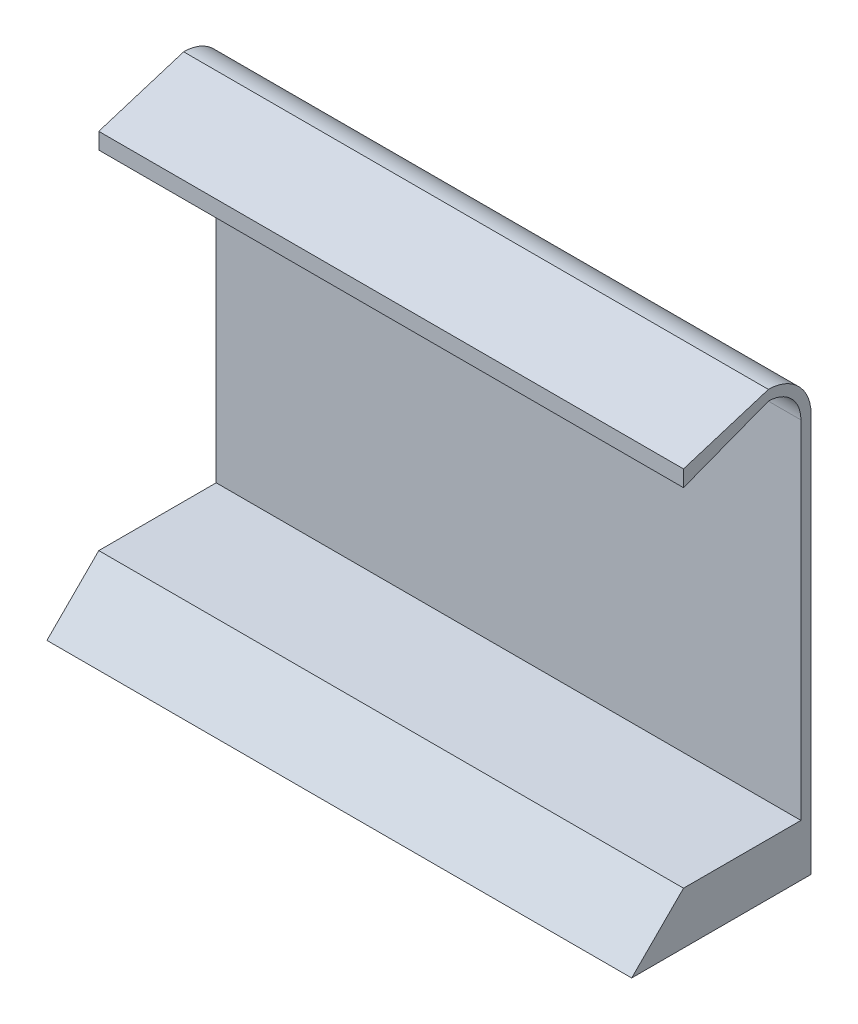
from build123d import *

# Parameters (mm, degrees)
BOSS_EXTRUDE1_DEPTH = 558.8


with BuildPart() as part:
    # Sketch1 → Boss-Extrude1 (new body)
    with BuildSketch(Plane(origin=(0, 0, 0), x_dir=(0, 0, -1), z_dir=(1, 0, 0))):
        with BuildLine():
            Line((0, 16.231012583), (0, -315.218136756))
            Line((0, -315.218136756), (-112.188138154, -315.218136756))
            Line((-112.188138154, -315.218136756), (-161.738988814, -364.768987417))
            Line((-161.738988814, -364.768987417), (0, -364.768987417))
            Line((0, -364.768987417), (9.710862229, -364.768987417))
            Line((9.710862229, -364.768987417), (9.710862229, 16.231012583))
            ThreePointArc((9.710862229, 16.231012583), (-2.234969693, 45.070802024), (-31.074759134, 57.016633947))
            Line((-31.074759134, 57.016633947), (-112.188138154, 31.76839215))
            Line((-112.188138154, 31.76839215), (-112.188138154, 16.231012583))
            Line((-112.188138154, 16.231012583), (-31.074759134, 47.305771717))
            ThreePointArc((-31.074759134, 47.305771717), (-9.101586227, 38.204185491), (0, 16.231012583))
        make_face()
    extrude(amount=BOSS_EXTRUDE1_DEPTH)


solid = part.part
